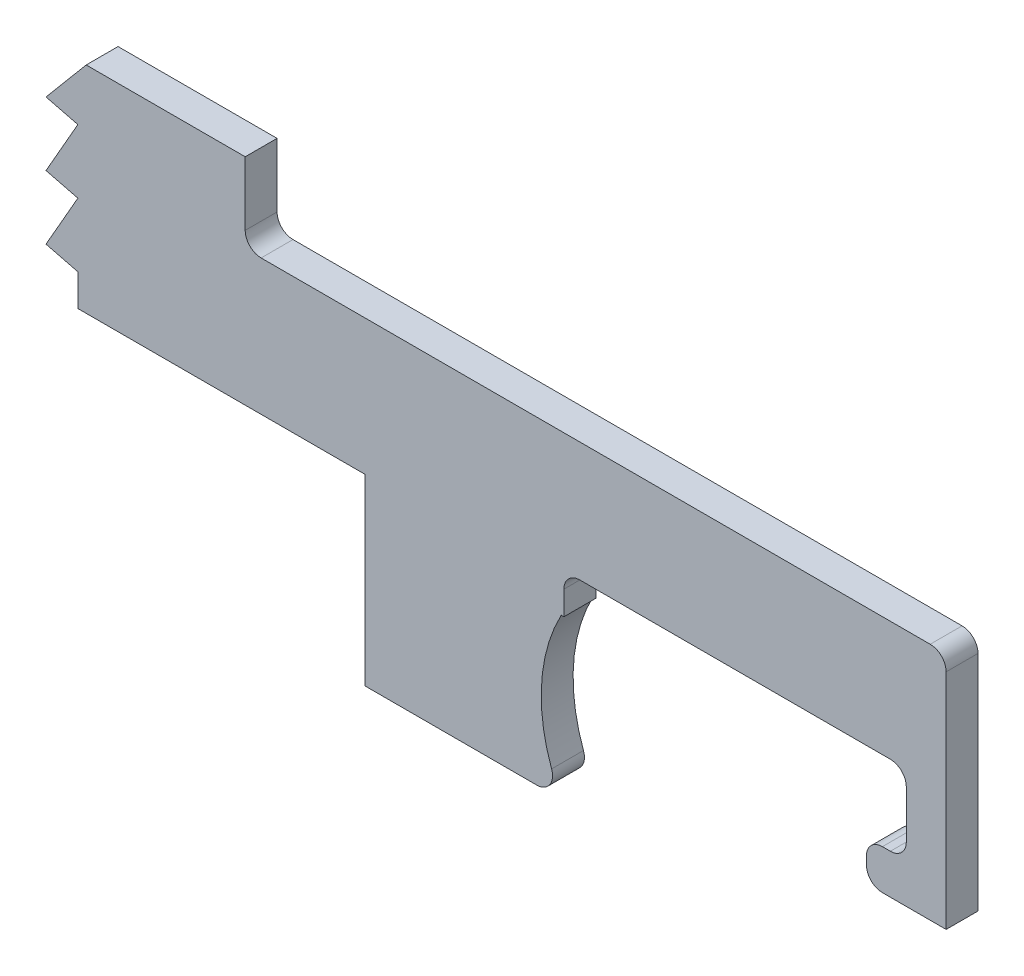
from build123d import *

# Parameters (mm, degrees)
BOSS_EXTRUDE1_DEPTH = 4
CUT_EXTRUDE1_DEPTH  = 10
FILLET1_R           = 2
FILLET2_R           = 2


with BuildPart() as part:
    # Sketch1 → Boss-Extrude1 (new body)
    with BuildSketch(Plane.XY):
        with BuildLine():
            Line((75.796342278, 15), (75.796342278, -15))
            Line((75.796342278, -15), (65.796342278, -15))
            Line((65.796342278, -15), (65.796342278, -10))
            Line((65.796342278, -10), (70.796342278, -10))
            Line((70.796342278, -10), (70.796342278, 0))
            Line((70.796342278, 0), (27.823693309, 0))
            Line((27.823693309, 0), (27.823693309, -5))
            Line((27.823693309, -5), (27.489306606, -5))
            ThreePointArc((27.489306606, -5), (24.977639534, -15), (27.489306606, -25))
            Line((27.489306606, -25), (2.888005027, -25))
            Line((2.888005027, -25), (2.888005027, -2))
            Line((2.888005027, -2), (-37.176306691, -2))
            Line((-37.176306691, -2), (-37.176306691, 25))
            Line((-37.176306691, 25), (-12.176306691, 25))
            Line((-12.176306691, 25), (-12.176306691, 15))
            Line((-12.176306691, 15), (75.796342278, 15))
        make_face()
    extrude(amount=BOSS_EXTRUDE1_DEPTH)

    # Sketch2 → Cut-Extrude1 (cut)
    with BuildSketch(Plane.XY.offset(4)):
        Polygon((-37.176306691, 19), (-32.133784184, 25), (-32.133784184, 30.908724767), (-39.468083963, 30.908724767), (-39.468083963, -2.242682287), (-33.176306691, -2.242682287), (-33.176306691, 2), (-37.176306691, 3), (-33.176306691, 10), (-37.176306691, 11), (-33.176306691, 18), align=None)
    extrude(amount=-CUT_EXTRUDE1_DEPTH, mode=Mode.SUBTRACT)

    # Fillet1
    fillet1_edges = [part.edges().sort_by_distance(p)[0] for p in [
        (65.796342278, -15, 2),
        (65.796342278, -10, 2),
        (70.796342278, -10, 2),
        (27.489306606, -25, 2),
    ]]
    fillet(fillet1_edges, radius=FILLET1_R)

    # Fillet2
    fillet2_edges = [part.edges().sort_by_distance(p)[0] for p in [
        (75.796342278, 15, 2),
        (70.796342278, 0, 2),
        (27.823693309, 0, 2),
        (-12.176306691, 15, 2),
    ]]
    fillet(fillet2_edges, radius=FILLET2_R)


solid = part.part
